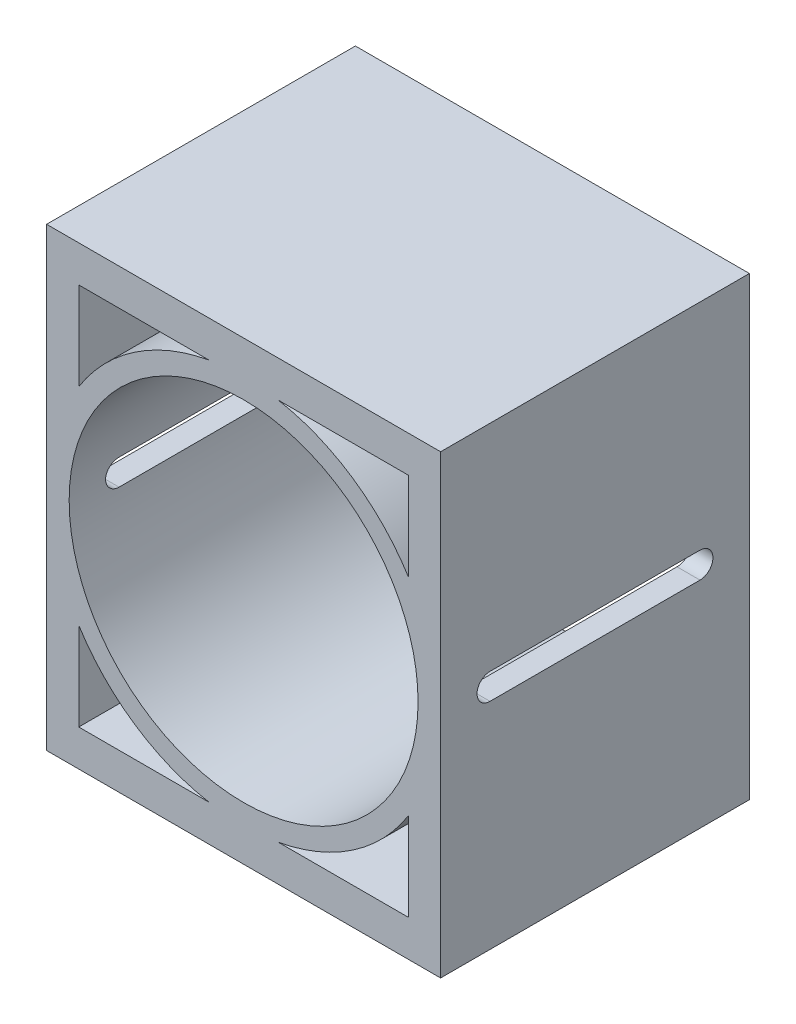
from build123d import *

# Parameters (mm, degrees)
SKETCH1_W            = 63.8
SKETCH1_H            = 73.8
SKETCH1_R            = 28.25
BOSS_EXTRUDE19_DEPTH = 10
SKETCH1_16_W         = 63.8
SKETCH1_16_H         = 73.8
SKETCH1_16_R         = 28.25
BOSS_EXTRUDE20_DEPTH = 50
CUT_EXTRUDE1_DEPTH   = 100


with BuildPart() as part:
    # Sketch1 → Boss-Extrude19 (new body)
    with BuildSketch(Plane.XY):
        Rectangle(SKETCH1_W, SKETCH1_H)
        with BuildLine():
            Line((-26.694444444, -31), (-26.694444444, -16.722937415))
            ThreePointArc((-26.694444444, -16.722937415), (-17.650289249, -26.090559393), (-5.590169944, -31))
            Line((-5.590169944, -31), (-26.694444444, -31))
        make_face(mode=Mode.SUBTRACT)
        with BuildLine():
            Line((26.694444444, -31), (5.590169944, -31))
            ThreePointArc((5.590169944, -31), (17.650289249, -26.090559393), (26.694444444, -16.722937415))
            Line((26.694444444, -16.722937415), (26.694444444, -31))
        make_face(mode=Mode.SUBTRACT)
        Circle(SKETCH1_R, mode=Mode.SUBTRACT)
        with BuildLine():
            Line((-26.694444444, 16.722937415), (-26.694444444, 31))
            Line((-26.694444444, 31), (-5.590169944, 31))
            ThreePointArc((-5.590169944, 31), (-17.650289249, 26.090559393), (-26.694444444, 16.722937415))
        make_face(mode=Mode.SUBTRACT)
        with BuildLine():
            ThreePointArc((26.694444444, 16.722937415), (17.650289249, 26.090559393), (5.590169944, 31))
            Line((5.590169944, 31), (26.694444444, 31))
            Line((26.694444444, 31), (26.694444444, 16.722937415))
        make_face(mode=Mode.SUBTRACT)
    extrude(amount=BOSS_EXTRUDE19_DEPTH)

    # Sketch1<16> → Boss-Extrude20 (add)
    with BuildSketch(Plane.XY):
        Rectangle(SKETCH1_16_W, SKETCH1_16_H)
        Circle(SKETCH1_16_R, mode=Mode.SUBTRACT)
        with BuildLine():
            Line((-26.694444444, -16.722937415), (-26.694444444, -31))
            Line((-26.694444444, -31), (-5.590169944, -31))
            ThreePointArc((-5.590169944, -31), (-17.650289249, -26.090559393), (-26.694444444, -16.722937415))
        make_face(mode=Mode.SUBTRACT)
        with BuildLine():
            Line((5.590169944, -31), (26.694444444, -31))
            Line((26.694444444, -31), (26.694444444, -16.722937415))
            ThreePointArc((26.694444444, -16.722937415), (17.650289249, -26.090559393), (5.590169944, -31))
        make_face(mode=Mode.SUBTRACT)
        with BuildLine():
            Line((5.590169944, 31), (26.694444444, 31))
            Line((26.694444444, 31), (26.694444444, 16.722937415))
            ThreePointArc((26.694444444, 16.722937415), (17.650289249, 26.090559393), (5.590169944, 31))
        make_face(mode=Mode.SUBTRACT)
        with BuildLine():
            Line((-26.694444444, 31), (-5.590169944, 31))
            ThreePointArc((-5.590169944, 31), (-17.650289249, 26.090559393), (-26.694444444, 16.722937415))
            Line((-26.694444444, 16.722937415), (-26.694444444, 31))
        make_face(mode=Mode.SUBTRACT)
    extrude(amount=BOSS_EXTRUDE20_DEPTH)

    # Sketch7 → Cut-Extrude1 (cut)
    with BuildSketch(Plane(origin=(40, 0, 0), x_dir=(0, 0, -1), z_dir=(1, 0, 0))):
        with BuildLine():
            Line((-42, 2.1), (-8, 2.1))
            ThreePointArc((-8, 2.1), (-5.9, 0), (-8, -2.1))
            Line((-8, -2.1), (-42, -2.1))
            ThreePointArc((-42, -2.1), (-44.1, 0), (-42, 2.1))
        make_face()
    extrude(amount=-CUT_EXTRUDE1_DEPTH, mode=Mode.SUBTRACT)


solid = part.part
